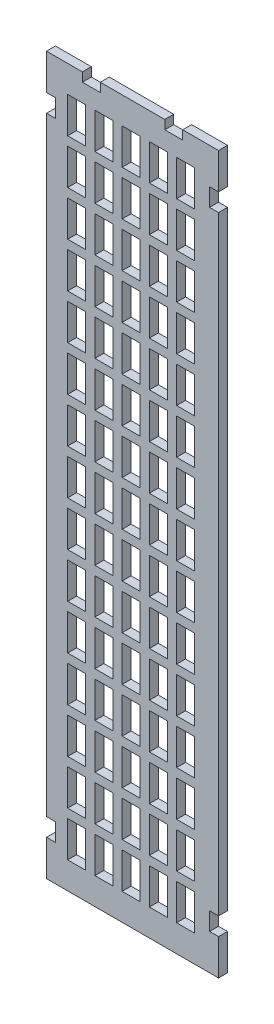
from build123d import *

# Parameters (mm, degrees)
BOSS_EXTRUDE1_DEPTH  = 3.175
SKETCH2_W            = 6.351539823
SKETCH2_H            = 12.7
CUT_EXTRUDE1_DEPTH   = 5.08
LPATTERN1_COUNT      = 5
LPATTERN1_PITCH      = 9.652
LPATTERN1_COUNT_DIR2 = 15
LPATTERN1_PITCH_DIR2 = 15.875


with BuildPart() as part:
    # Sketch1 → Boss-Extrude1 (new body)
    with BuildSketch(Plane.XY):
        Polygon((0, -254), (12.7, -254), (48.26, -254), (60.96, -254), (60.96, -241.3), (57.785, -241.3), (57.785, -234.95), (60.96, -234.95), (60.96, -19.05), (57.785, -19.05), (57.785, -12.7), (60.96, -12.7), (60.96, 0), (48.26, 0), (48.26, -3.175), (41.91, -3.175), (41.91, 0), (19.05, 0), (19.05, -3.175), (12.7, -3.175), (12.7, 0), (0, 0), (0, -12.7), (3.175, -12.7), (3.175, -19.05), (0, -19.05), (0, -234.95), (3.175, -234.95), (3.175, -241.3), (0, -241.3), align=None)
    extrude(amount=BOSS_EXTRUDE1_DEPTH)

    # Sketch2 → Cut-Extrude1 (cut)
    with BuildSketch(Plane.XY.offset(3.175)):
        with Locations((10.668769912, -15.875)):
            Rectangle(SKETCH2_W, SKETCH2_H)
    cut_extrude1 = extrude(amount=-CUT_EXTRUDE1_DEPTH, mode=Mode.SUBTRACT)

    # LPattern1: Cut-Extrude1 5 × 15
    with Locations(*[(i * LPATTERN1_PITCH, -j * LPATTERN1_PITCH_DIR2, 0) for i in range(LPATTERN1_COUNT) for j in range(LPATTERN1_COUNT_DIR2) if (i, j) != (0, 0)]):
        add(cut_extrude1, mode=Mode.SUBTRACT)


solid = part.part
